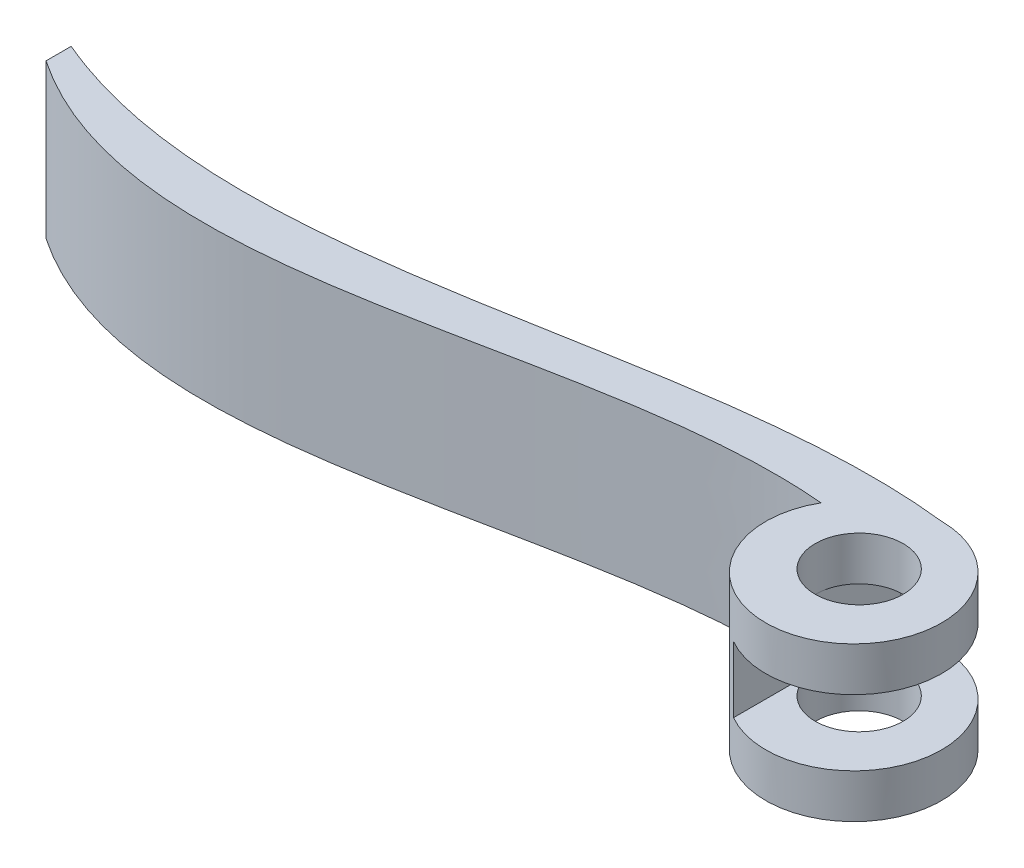
from build123d import *

# Parameters (mm, degrees)
SKETCH1_R           = 4
BOSS_EXTRUDE1_DEPTH = 14
SKETCH2_W           = 12
SKETCH2_H           = 6
CUT_EXTRUDE1_DEPTH  = 17


with BuildPart() as part:
    # Sketch1 → Boss-Extrude1 (new body)
    with BuildSketch(Plane(origin=(0, 0, 0), x_dir=(1, 0, 0), z_dir=(0, 1, 0))):
        with BuildLine():
            Line((-76.999999986, 5.832514168), (-76.999999986, 3.540882964))
            add(Edge.make_bspline(
                [(-6.942295947, 3.975490785), (-13.088937843, 4.53703129), (-37.064176348, 1.721893834), (-62.004711992, -6.566542107), (-76.999999986, 3.540882964)],
                knots=[0.045717223, 0.045717223, 0.045717223, 0.045717223, 0.30042167, 1, 1, 1, 1], degree=3))
            ThreePointArc((-6.942295947, 3.975490785), (4.012235893, -6.921124413), (0, 8))
            add(Edge.make_bspline(
                [(0, 8), (-24.867463869, 10.892678598), (-52.765963903, -4.510038737), (-76.999999986, 5.832514168)],
                knots=[0, 0, 0, 0, 1, 1, 1, 1], degree=3))
        make_face()
        with Locations(Location((0, 0.5, 0), (0, 0, 270))):
            Circle(SKETCH1_R, mode=Mode.SUBTRACT)
    extrude(amount=BOSS_EXTRUDE1_DEPTH)

    # Sketch2 → Cut-Extrude1 (cut, symmetric)
    with BuildSketch(Plane.XY):
        with Locations((2, 7)):
            Rectangle(SKETCH2_W, SKETCH2_H)
    extrude(amount=CUT_EXTRUDE1_DEPTH, both=True, mode=Mode.SUBTRACT)


solid = part.part
